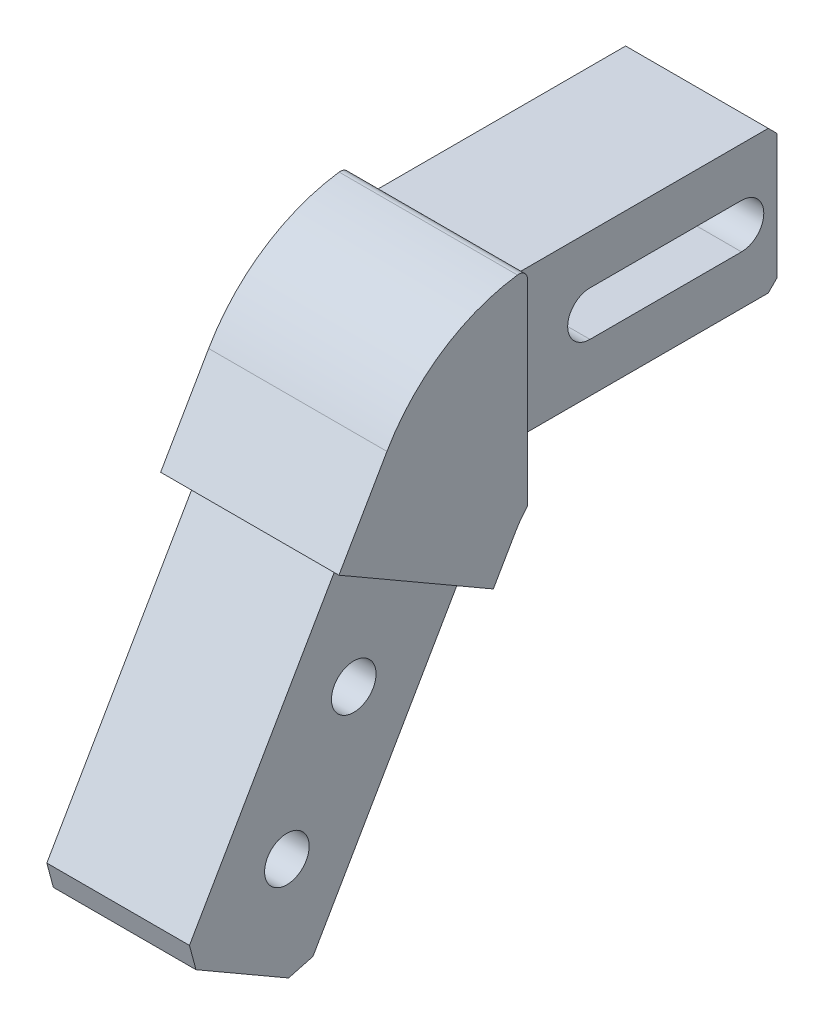
from build123d import *

# Parameters (mm, degrees)
SKETCH1_R                = 2.5
BOSS_EXTRUDE1_DEPTH      = 16
BOSS_EXTRUDE2_DEPTH      = 2
BOSS_EXTRUDE2_DEPTH_BACK = 18
CHAMFER1_SIZE            = 2
FILLET1_R                = 1


with BuildPart() as part:
    # Sketch1 → Boss-Extrude1 (new body)
    with BuildSketch(Plane(origin=(0, 0, 0), x_dir=(0, 0, -1), z_dir=(1, 0, 0))):
        with BuildLine():
            Line((40, 3), (40, 17))
            Line((40, 17), (39, 18))
            Line((39, 18), (15, 18))
            Line((15, 18), (10, 18))
            Line((10, 18), (10, 19.940079597))
            ThreePointArc((10, 19.940079597), (0.884122958, 16.920488715), (-5.773502692, 10))
            Line((-5.773502692, 10), (-11.160254038, 0.669872981))
            Line((-11.160254038, 0.669872981), (-9.42820323, -0.330127019))
            Line((-9.42820323, -0.330127019), (-26.92820323, -30.641016151))
            Line((-26.92820323, -30.641016151), (-13.07179677, -38.641016151))
            Line((-13.07179677, -38.641016151), (4.42820323, -8.330127019))
            Line((4.42820323, -8.330127019), (6.160254038, -9.330127019))
            Line((6.160254038, -9.330127019), (8.660254038, -5))
            ThreePointArc((8.660254038, -5), (9.278898856, -4.055883484), (10, -3.187499614))
            Line((10, -3.187499614), (10, 2))
            Line((10, 2), (15, 2))
            Line((15, 2), (39, 2))
            Line((39, 2), (40, 3))
        make_face()
        with Locations((-15, -25.980762114)):
            Circle(SKETCH1_R, mode=Mode.SUBTRACT)
        with Locations((-7.5, -12.990381057)):
            Circle(SKETCH1_R, mode=Mode.SUBTRACT)
        with BuildLine():
            Line((19, 12.5), (36, 12.5))
            ThreePointArc((36, 12.5), (38.5, 10), (36, 7.5))
            Line((36, 7.5), (19, 7.5))
            ThreePointArc((19, 7.5), (16.5, 10), (19, 12.5))
        make_face(mode=Mode.SUBTRACT)
    extrude(amount=BOSS_EXTRUDE1_DEPTH)

    # Sketch2 → Boss-Extrude2 (add, two sides: drawn at the far end of the back side and taken through both)
    with BuildSketch(Plane(origin=(16, 0, 0), x_dir=(0, 0, -1), z_dir=(1, 0, 0)).offset(-BOSS_EXTRUDE2_DEPTH_BACK)):
        with BuildLine():
            Line((-11.160254038, 0.669872981), (6.160254038, -9.330127019))
            Line((6.160254038, -9.330127019), (8.660254038, -5))
            ThreePointArc((8.660254038, -5), (9.278898856, -4.055883484), (10, -3.187499614))
            Line((10, -3.187499614), (10, 19.940079597))
            ThreePointArc((10, 19.940079597), (0.884122958, 16.920488715), (-5.773502692, 10))
            Line((-5.773502692, 10), (-11.160254038, 0.669872981))
        make_face()
    extrude(amount=BOSS_EXTRUDE2_DEPTH + BOSS_EXTRUDE2_DEPTH_BACK)

    # Chamfer1
    chamfer1_edges = [part.edges().sort_by_distance(p)[0] for p in [
        (8, -38.641016151, 13.07179677),
        (8, -30.641016151, 26.92820323),
    ]]
    chamfer(chamfer1_edges, length=CHAMFER1_SIZE)

    # Fillet1
    fillet1_edges = [part.edges().sort_by_distance(p)[0] for p in [
        (8, 19.940079597, -10),
    ]]
    fillet(fillet1_edges, radius=FILLET1_R)


solid = part.part
